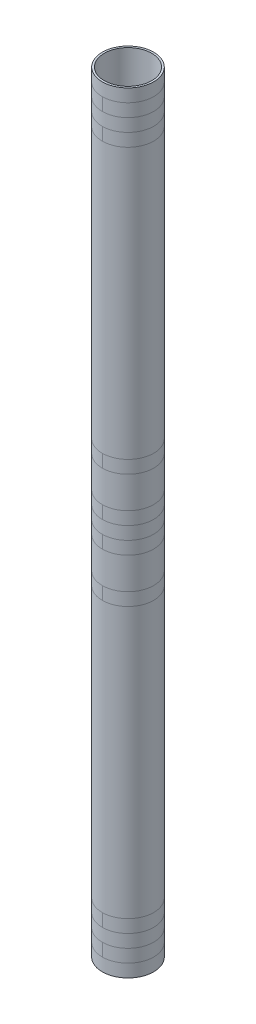
from build123d import *

# Parameters (mm, degrees)
SKETCH1_R           = 20
BOSS_EXTRUDE1_DEPTH = 600
SKETCH5_R           = 18.5
CUT_EXTRUDE1_DEPTH  = 600


with BuildPart() as part:
    # Sketch1 → Boss-Extrude1 (new body)
    with BuildSketch(Plane(origin=(0, 0, 0), x_dir=(1, 0, 0), z_dir=(0, 1, 0))):
        with Locations(Location((0, 0, 0), (0, 0, 270))):
            Circle(SKETCH1_R)
    extrude(amount=BOSS_EXTRUDE1_DEPTH)

    # Sketch5 → Cut-Extrude1 (cut)
    with BuildSketch(Plane(origin=(0, 600, 0), x_dir=(1, 0, 0), z_dir=(0, 1, 0))):
        with Locations(Location((0, 0, 0), (0, 0, 270))):
            Circle(SKETCH5_R)
    extrude(amount=-CUT_EXTRUDE1_DEPTH, mode=Mode.SUBTRACT)


solid = part.part
